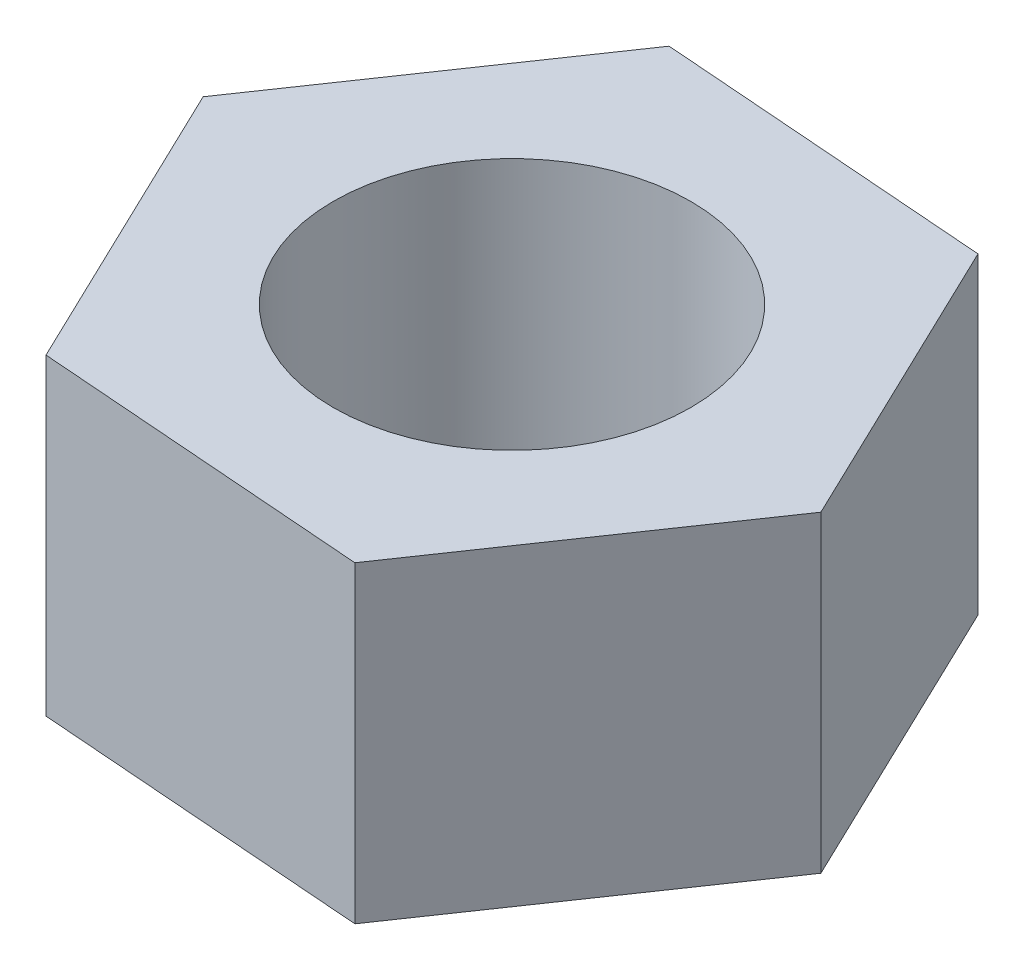
from build123d import *

# Parameters (mm, degrees)
SKETCH_1_R      = 4
EXTRUDE_1_DEPTH = 7


with BuildPart() as part:
    # Эскиз1 → Вытянуть1 (new body)
    with BuildSketch(Plane(origin=(0, 0, 0), x_dir=(1, 0, 0), z_dir=(0, 1, 0))):
        Polygon((3.248877823, -6.76595346), (7.483926489, -0.569366002), (4.235048666, 6.196587458), (-3.248877823, 6.76595346), (-7.483926489, 0.569366002), (-4.235048666, -6.196587458), align=None)
        with Locations(Location((0, 0, 0), (0, 0, 270))):
            Circle(SKETCH_1_R, mode=Mode.SUBTRACT)
    extrude(amount=EXTRUDE_1_DEPTH)


solid = part.part
